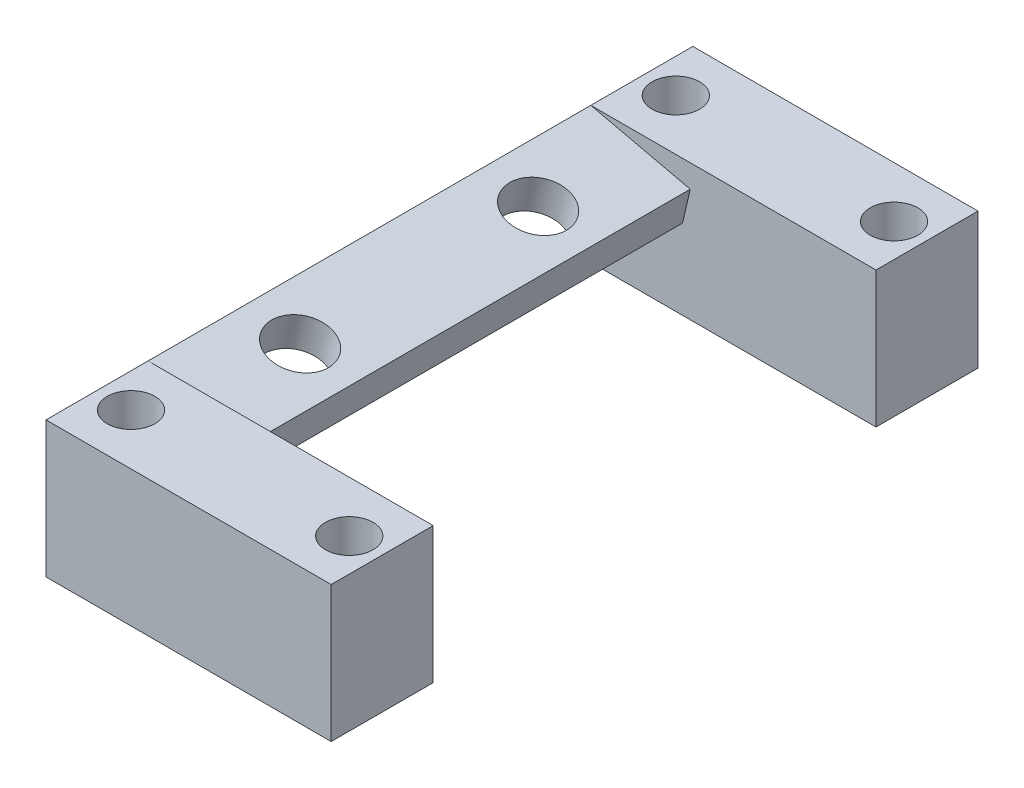
from build123d import *

# Parameters (mm, degrees)
SKETCH1_W           = 21.30000058
SKETCH1_H           = 10.16
BOSS_EXTRUDE1_DEPTH = 7.62
BOSS_EXTRUDE2_DEPTH = 33.0708
SKETCH4_W           = 21.30000058
SKETCH4_H           = 10.16
BOSS_EXTRUDE4_DEPTH = 7.62
SKETCH5_R           = 1.778
CUT_EXTRUDE1_DEPTH  = 10.16
SKETCH6_R           = 1.778
CUT_EXTRUDE2_DEPTH  = 10.16
SKETCH7_R           = 2.1717
CUT_EXTRUDE3_DEPTH  = 2.54


with BuildPart() as part:
    # Sketch1 → Boss-Extrude1 (new body)
    with BuildSketch(Plane.XY):
        with Locations((-25.057547882, 15.775525439)):
            Rectangle(SKETCH1_W, SKETCH1_H)
    extrude(amount=BOSS_EXTRUDE1_DEPTH)

    # Sketch2 → Boss-Extrude2 (add)
    with BuildSketch(Plane(origin=(0, 0, 0), x_dir=(-1, 0, 0), z_dir=(0, 0, -1))):
        Polygon((28.282848278, 19.141398405), (35.707548172, 20.855525439), (36.27892385, 18.380625474), (28.854223956, 16.66649844), align=None)
    extrude(amount=BOSS_EXTRUDE2_DEPTH)

    # Sketch5 → Cut-Extrude1 (cut)
    with BuildSketch(Plane(origin=(0, 20.855525439, 0), x_dir=(1, 0, 0), z_dir=(0, 1, 0))):
        with Locations(Location((-33.167548172, -3.81, 0), (0, 0, 270))):
            Circle(SKETCH5_R)
        with Locations(Location((-16.867547752, -3.81, 0), (0, 0, 270))):
            Circle(SKETCH5_R)
    extrude(amount=-CUT_EXTRUDE1_DEPTH, mode=Mode.SUBTRACT)

    # Sketch7 → Cut-Extrude3 (cut)
    with BuildSketch(Plane(origin=(2.764322068, 11.973594347, 0), x_dir=(0.9743700647852351, -0.2249510543438655, 0), z_dir=(0.2249510543438655, 0.9743700647852351, 0))):
        with Locations(Location((-35.673838462, 7.6454, 0), (0, 0, 180))):
            Circle(SKETCH7_R)
        with Locations(Location((-35.673838462, 25.4254, 0), (0, 0, 180))):
            Circle(SKETCH7_R)
    extrude(amount=-CUT_EXTRUDE3_DEPTH, mode=Mode.SUBTRACT)


with BuildPart() as body_2:
    # Sketch4 → Boss-Extrude4 (new body)
    with BuildSketch(Plane(origin=(0, 0, -33.0708), x_dir=(-1, 0, 0), z_dir=(0, 0, -1))):
        with Locations((25.057547882, 15.775525439)):
            Rectangle(SKETCH4_W, SKETCH4_H)
    extrude(amount=BOSS_EXTRUDE4_DEPTH)

    # Sketch6 → Cut-Extrude2 (cut)
    with BuildSketch(Plane(origin=(0, 20.855525439, 0), x_dir=(1, 0, 0), z_dir=(0, 1, 0))):
        with Locations(Location((-33.167548172, 36.8808, 0), (0, 0, 180))):
            Circle(SKETCH6_R)
        with Locations(Location((-16.867547752, 36.8808, 0), (0, 0, 180))):
            Circle(SKETCH6_R)
    extrude(amount=-CUT_EXTRUDE2_DEPTH, mode=Mode.SUBTRACT)


solid = Compound([part.part, body_2.part])
